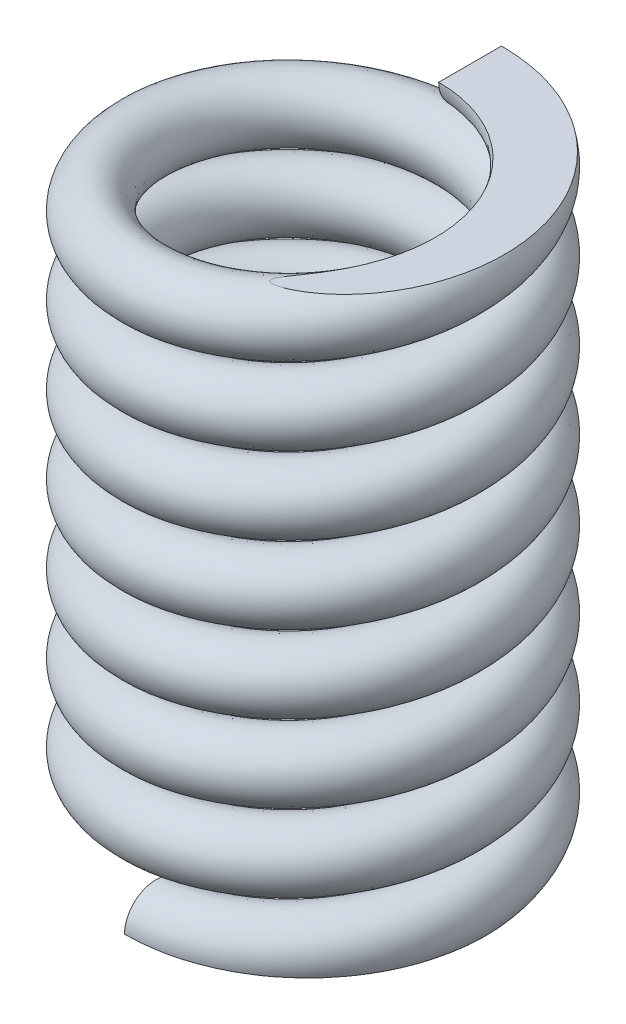
from build123d import *

# Parameters (mm, degrees)
SWEEP_1_PITCH  = 3.08
SWEEP_1_HEIGHT = 23.1
SWEEP_1_RADIUS = 7.5
SKETCH_2_R     = 1.25


with BuildPart() as part:
    # По траектории1: sweep along a helix
    with BuildLine() as sweep_1_path:
        Helix(SWEEP_1_PITCH, SWEEP_1_HEIGHT, SWEEP_1_RADIUS, center=(0, 0, 0), direction=(0, 1, 0))
    # Эскиз2 → По траектории1 (sweep)
    with BuildSketch(Plane(origin=(0, 0, 0), x_dir=(0, 0, -1), z_dir=(1, 0, 0))):
        with Locations((-6.25, 0)):
            Circle(SKETCH_2_R)
    sweep(path=sweep_1_path.line, is_frenet=True)

    # Surface Cut 1
    split(bisect_by=Plane(origin=(0, 0, 0), x_dir=(1, 0, 0), z_dir=(0, 1, 0)), keep=Keep.TOP)

    # Surface Cut 2
    split(bisect_by=Plane(origin=(0, 23.1, 0), x_dir=(1, 0, 0), z_dir=(0, 1, 0)), keep=Keep.BOTTOM)


solid = part.part
